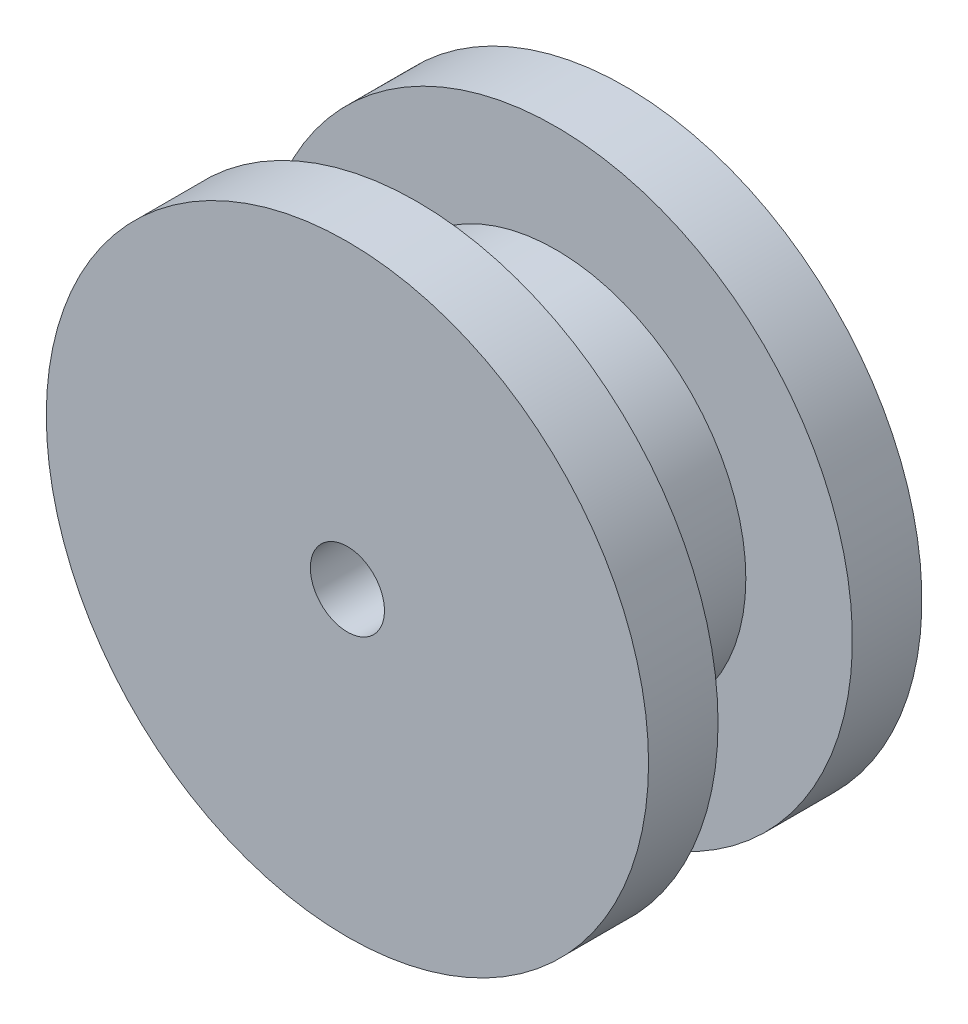
from build123d import *

# Parameters (mm, degrees)
SKETCH1_R           = 20.5
BOSS_EXTRUDE1_DEPTH = 15
SKETCH2_R           = 32.5
BOSS_EXTRUDE2_DEPTH = 7.5
SKETCH3_R           = 32
BOSS_EXTRUDE3_DEPTH = 7.5
SKETCH4_R           = 4
CUT_EXTRUDE1_DEPTH  = 30


with BuildPart() as part:
    # Sketch1 → Boss-Extrude1 (new body)
    with BuildSketch(Plane.XY):
        Circle(SKETCH1_R)
    extrude(amount=BOSS_EXTRUDE1_DEPTH)

    # Sketch2 → Boss-Extrude2 (add)
    with BuildSketch(Plane.XY.offset(15)):
        Circle(SKETCH2_R)
    extrude(amount=BOSS_EXTRUDE2_DEPTH)

    # Sketch3 → Boss-Extrude3 (add)
    with BuildSketch(Plane(origin=(0, 0, 0), x_dir=(-1, 0, 0), z_dir=(0, 0, -1))):
        Circle(SKETCH3_R)
    extrude(amount=BOSS_EXTRUDE3_DEPTH)

    # Sketch4 → Cut-Extrude1 (cut)
    with BuildSketch(Plane(origin=(0, 0, -7.5), x_dir=(-1, 0, 0), z_dir=(0, 0, -1))):
        Circle(SKETCH4_R)
    extrude(amount=-CUT_EXTRUDE1_DEPTH, mode=Mode.SUBTRACT)


solid = part.part
